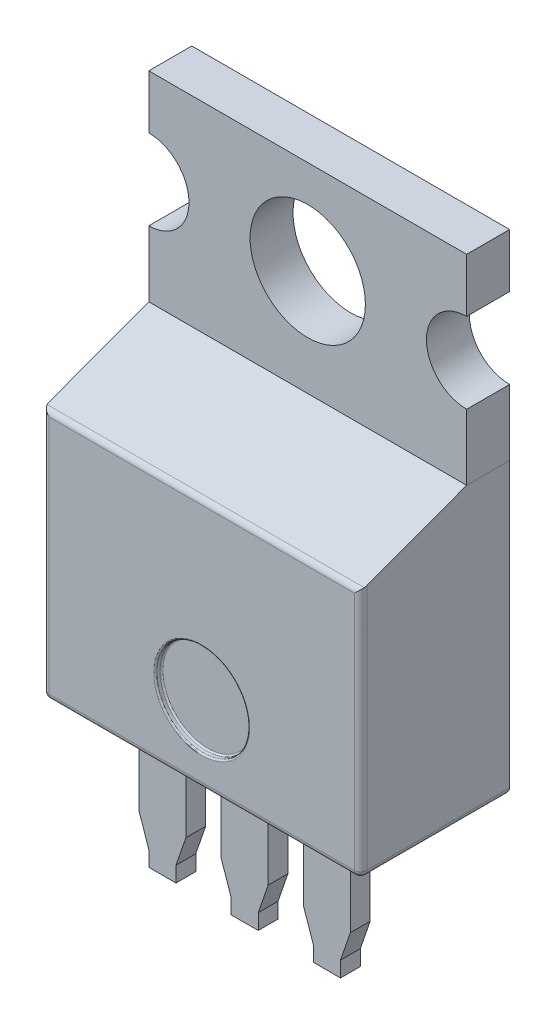
from build123d import *

# Parameters (mm, degrees)
SKETCH_1_W          = 0.88
SKETCH_1_H          = 0.64
EXTRUDE_1_DEPTH     = 0.5
EXTRUDE_1_2_DEPTH   = 0.5
EXTRUDE_1_3_DEPTH   = 0.5
SKETCH_2_7_W        = 1.52
SKETCH_2_7_H        = 0.64
EXTRUDE_2_DEPTH     = 3
SKETCH_4_W          = 10.28
SKETCH_4_H          = 4.82
EXTRUDE_3_DEPTH     = 8.1
SKETCH_5_2_W        = 10.28
SKETCH_5_2_H        = 1.39
EXTRUDE_4_DEPTH     = 6.47
SKETCH_8_R          = 1.865
CUT_EXTRUDE_1_DEPTH = 1.39
SKETCH_9_R          = 1.5
CUT_EXTRUDE_2_DEPTH = 0.2
FILLET_2_R          = 0.05
SKETCH_10_R         = 1.3
CUT_EXTRUDE_3_DEPTH = 1.39
FILLET_4_R          = 0.2


with BuildPart() as part:
    # Эскиз1 → Бобышка-Вытянуть1 (new body)
    with BuildSketch(Plane(origin=(0, 0, 0), x_dir=(1, 0, 0), z_dir=(0, 1, 0))):
        with Locations((2.66, 0)):
            Rectangle(SKETCH_1_W, SKETCH_1_H)
    extrude(amount=-EXTRUDE_1_DEPTH)

    # Эскиз2<6> → По сечениям3 section 0
    with BuildSketch(Plane(origin=(0, 0.93, 0), x_dir=(1, 0, 0), z_dir=(0, 1, 0))):
        with BuildLine():
            Line((1.9, 0.32), (1.9, -0.32))
            Line((1.9, -0.32), (3.42, -0.32))
            Line((3.42, -0.32), (3.42, 0.32))
            Line((3.42, 0.32), (1.9, 0.32))
        make_face()
    # Эскиз3<6> → По сечениям3 section 1
    with BuildSketch(Plane(origin=(0, 0, 0), x_dir=(1, 0, 0), z_dir=(0, 1, 0))):
        with BuildLine():
            Line((2.22, 0.32), (3.1, 0.32))
            Line((3.1, 0.32), (3.1, -0.32))
            Line((3.1, -0.32), (2.22, -0.32))
            Line((2.22, -0.32), (2.22, 0.32))
        make_face()
    loft()



with BuildPart() as body_2:
    # Эскиз1 → Extrude 1 2 (new body)
    with BuildSketch(Plane(origin=(0, 0, 0), x_dir=(1, 0, 0), z_dir=(0, 1, 0))):
        Rectangle(SKETCH_1_W, SKETCH_1_H)
    extrude(amount=-EXTRUDE_1_2_DEPTH)

    # Эскиз2<5> → По сечениям2 section 0
    with BuildSketch(Plane(origin=(0, 0.93, 0), x_dir=(1, 0, 0), z_dir=(0, 1, 0))):
        with BuildLine():
            Line((-0.76, 0.32), (0.76, 0.32))
            Line((0.76, 0.32), (0.76, -0.32))
            Line((0.76, -0.32), (-0.76, -0.32))
            Line((-0.76, -0.32), (-0.76, 0.32))
        make_face()
    # Эскиз3<5> → По сечениям2 section 1
    with BuildSketch(Plane(origin=(0, 0, 0), x_dir=(1, 0, 0), z_dir=(0, 1, 0))):
        with BuildLine():
            Line((-0.44, 0.32), (0.44, 0.32))
            Line((0.44, 0.32), (0.44, -0.32))
            Line((0.44, -0.32), (-0.44, -0.32))
            Line((-0.44, -0.32), (-0.44, 0.32))
        make_face()
    loft()


with BuildPart() as body_3:
    # Эскиз1 → Extrude 1 3 (new body)
    with BuildSketch(Plane(origin=(0, 0, 0), x_dir=(1, 0, 0), z_dir=(0, 1, 0))):
        with Locations((-2.66, 0)):
            Rectangle(SKETCH_1_W, SKETCH_1_H)
    extrude(amount=-EXTRUDE_1_3_DEPTH)

    # Эскиз3 → По сечениям1 section 0
    with BuildSketch(Plane(origin=(0, 0, 0), x_dir=(1, 0, 0), z_dir=(0, 1, 0))):
        with BuildLine():
            Line((-3.1, 0.32), (-2.22, 0.32))
            Line((-2.22, 0.32), (-2.22, -0.32))
            Line((-2.22, -0.32), (-3.1, -0.32))
            Line((-3.1, -0.32), (-3.1, 0.32))
        make_face()
    # Эскиз2 → По сечениям1 section 1
    with BuildSketch(Plane(origin=(0, 0.93, 0), x_dir=(1, 0, 0), z_dir=(0, 1, 0))):
        with BuildLine():
            Line((-3.42, 0.32), (-3.42, -0.32))
            Line((-3.42, -0.32), (-1.9, -0.32))
            Line((-1.9, -0.32), (-1.9, 0.32))
            Line((-1.9, 0.32), (-3.42, 0.32))
        make_face()
    loft()


with BuildPart() as part_1:
    add(part.part)

    add(body_2.part)  # Бобышка-Вытянуть2 merges body 2

    add(body_3.part)  # Бобышка-Вытянуть2 merges body 3
    # Эскиз2<7> → Бобышка-Вытянуть2 (add)
    with BuildSketch(Plane(origin=(0, 0.93, 0), x_dir=(1, 0, 0), z_dir=(0, 1, 0))):
        Rectangle(SKETCH_2_7_W, SKETCH_2_7_H)
        with Locations((2.66, 0)):
            Rectangle(SKETCH_2_7_W, SKETCH_2_7_H)
        with Locations((-2.66, 0)):
            Rectangle(SKETCH_2_7_W, SKETCH_2_7_H)
    extrude(amount=EXTRUDE_2_DEPTH)

    # Эскиз4 → Бобышка-Вытянуть3 (add)
    with BuildSketch(Plane(origin=(0, 3.93, 0), x_dir=(1, 0, 0), z_dir=(0, 1, 0))):
        with Locations((0, 0.7)):
            Rectangle(SKETCH_4_W, SKETCH_4_H)
    extrude(amount=EXTRUDE_3_DEPTH)

    # Эскиз5 → section 0 of loft_4
    with BuildSketch(Plane(origin=(0, 13.3, 0), x_dir=(1, 0, 0), z_dir=(0, 1, 0)), mode=Mode.PRIVATE) as loft_4_s0:
        with BuildLine():
            Line((-5.14, 3.11), (5.14, 3.11))
            Line((5.14, 3.11), (5.14, 1.72))
            Line((5.14, 1.72), (-5.14, 1.72))
            Line((-5.14, 1.72), (-5.14, 3.11))
        make_face()
    # loft up to a face of the part (loft_4)
    loft([loft_4_s0.sketch, part_1.faces().sort_by_distance((0, 12.03, -0.7))[0]])

    # Эскиз9 → Вырез-Вытянуть2 (cut)
    with BuildSketch(Plane.XY.offset(1.71)):
        with Locations((0, 6.43)):
            Circle(SKETCH_9_R)
    extrude(amount=-CUT_EXTRUDE_2_DEPTH, mode=Mode.SUBTRACT)

    # Скругление2
    fillet_2_edges = [part_1.edges().sort_by_distance(p)[0] for p in [
        (-1.5, 6.43, 1.51),
        (-1.5, 6.43, 1.71),
    ]]
    fillet(fillet_2_edges, radius=FILLET_2_R)

    # Скругление4
    fillet_4_edges = [part_1.edges().sort_by_distance(p)[0] for p in [
        (5.14, 3.93, -0.7),
        (5.14, 7.98, 1.71),
        (0, 3.93, -3.11),
        (-5.14, 3.93, -0.7),
        (0, 3.93, 1.71),
        (-5.14, 7.98, 1.71),
        (0, 12.03, 1.71),
    ]]
    fillet(fillet_4_edges, radius=FILLET_4_R)


with BuildPart() as body_2_2:
    # Эскиз5<2> → Бобышка-Вытянуть4 (new body)
    with BuildSketch(Plane(origin=(0, 13.3, 0), x_dir=(1, 0, 0), z_dir=(0, 1, 0))):
        with Locations((0, 2.415)):
            Rectangle(SKETCH_5_2_W, SKETCH_5_2_H)
    extrude(amount=EXTRUDE_4_DEPTH)

    # Эскиз8 → Вырез-Вытянуть1 (cut)
    with BuildSketch(Plane.XY.offset(-1.72)):
        with Locations((0, 16.73)):
            Circle(SKETCH_8_R)
    extrude(amount=-CUT_EXTRUDE_1_DEPTH, mode=Mode.SUBTRACT)

    # Эскиз10 → Вырез-Вытянуть3 (cut)
    with BuildSketch(Plane.XY.offset(-1.72)):
        with Locations((5.14, 16.73)):
            Circle(SKETCH_10_R)
        with Locations((-5.14, 16.73)):
            Circle(SKETCH_10_R)
    extrude(amount=-CUT_EXTRUDE_3_DEPTH, mode=Mode.SUBTRACT)


solid = Compound([part_1.part, body_2_2.part])
